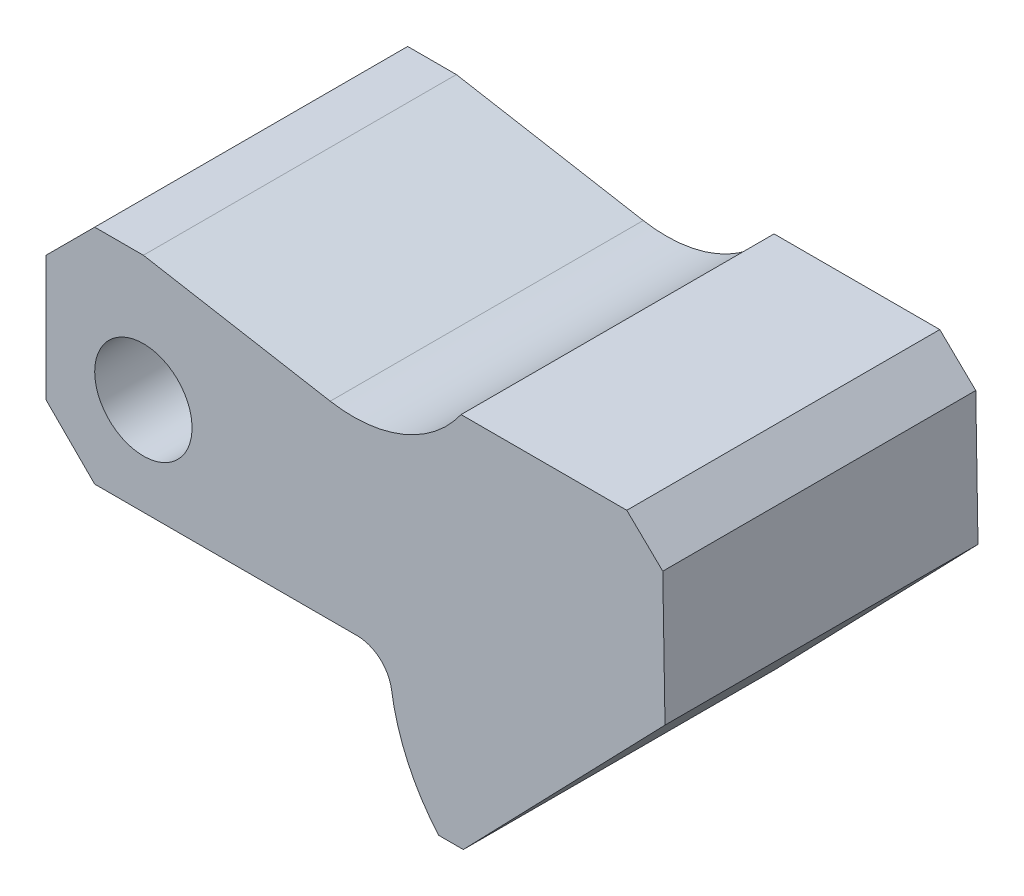
from build123d import *

# Parameters (mm, degrees)
SKETCH1_R           = 7
BOSS_EXTRUDE1_DEPTH = 45


with BuildPart() as part:
    # Sketch1 → Boss-Extrude1 (new body)
    with BuildSketch(Plane.XY):
        with BuildLine():
            Line((0, 0), (-7, 7))
            Line((-7, 7), (-7, 25))
            Line((-7, 25), (0, 32))
            Line((0, 32), (7, 32))
            Line((7, 32), (33.868127266, 27.262424242))
            ThreePointArc((33.868127266, 27.262424242), (44.39557659, 28.402372071), (52.677966102, 35))
            Line((52.677966102, 35), (76.505552309, 35))
            Line((76.505552309, 35), (81.677966102, 30))
            Line((81.677966102, 30), (82, 11))
            Line((82, 11), (53, -19))
            Line((53, -19), (49.457764366, -19))
            ThreePointArc((49.457764366, -19), (45.01879217, -12.115672061), (42.681961966, -4.264705882))
            ThreePointArc((42.681961966, -4.264705882), (41.001559006, -1.213413768), (37.736323225, 0))
            Line((37.736323225, 0), (0, 0))
        make_face()
        with Locations(Location((7, 14, 0), (0, 0, 180))):
            Circle(SKETCH1_R, mode=Mode.SUBTRACT)
    extrude(amount=BOSS_EXTRUDE1_DEPTH)


solid = part.part
